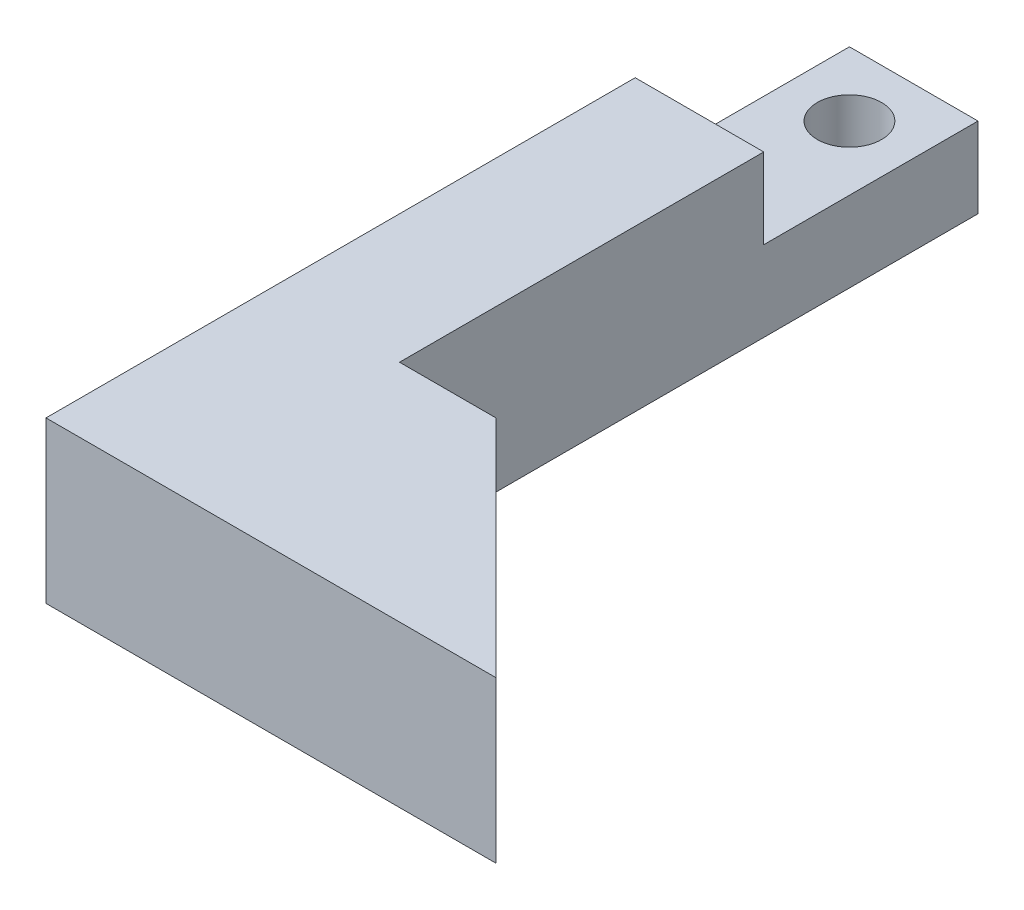
from build123d import *

# Parameters (mm, degrees)
BOSS_EXTRUDE1_DEPTH = 50
SKETCH2_R           = 10
CUT_EXTRUDE1_DEPTH  = 77
SCALE1_SCALE        = 0.75
SKETCH4_W           = 30
SKETCH4_H           = 50
CUT_EXTRUDE2_DEPTH  = 18.75


with BuildPart() as part:
    # Sketch1 → Boss-Extrude1 (new body)
    with BuildSketch(Plane(origin=(0, 0, 0), x_dir=(1, 0, 0), z_dir=(0, 1, 0))):
        Polygon((50, -77.599909443), (120, -147.599909443), (50, -147.599909443), (-20, -147.599909443), (-20, 102.400090557), (20, 102.400090557), (20, -77.599909443), align=None)
    extrude(amount=BOSS_EXTRUDE1_DEPTH)

    # Sketch2 → Cut-Extrude1 (cut)
    with BuildSketch(Plane(origin=(0, 50, 0), x_dir=(1, 0, 0), z_dir=(0, 1, 0))):
        with Locations(Location((0, 82.400090557, 0), (0, 0, 270))):
            Circle(SKETCH2_R)
    extrude(amount=-CUT_EXTRUDE1_DEPTH, mode=Mode.SUBTRACT)


with BuildPart() as part_1:
    # Scale1: scaled about (17.783752388, 25, 55.690336976)
    add(part.part.scale(SCALE1_SCALE).moved(Location((4.445938097, 6.25, 13.922584244))))

    # Sketch4 → Cut-Extrude2 (cut)
    with BuildSketch(Plane(origin=(0, 43.75, 0), x_dir=(1, 0, 0), z_dir=(0, 1, 0))):
        with Locations((4.445938097, 37.877483673)):
            Rectangle(SKETCH4_W, SKETCH4_H)
    extrude(amount=-CUT_EXTRUDE2_DEPTH, mode=Mode.SUBTRACT)


solid = part_1.part
